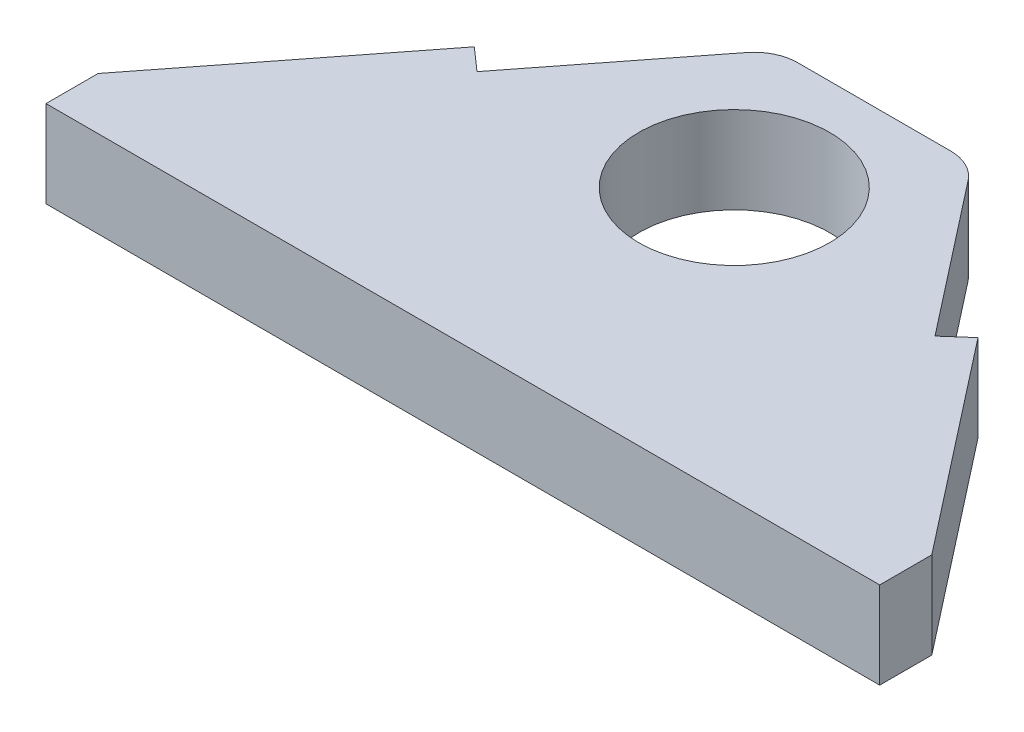
from build123d import *

# Parameters (mm, degrees)
SKETCH1_R           = 22
BOSS_EXTRUDE1_DEPTH = 20


with BuildPart() as part:
    # Sketch1 → Boss-Extrude1 (new body)
    # profile 1 of 4: a face of its own
    with BuildSketch(Plane(origin=(0, 0, 0), x_dir=(1, 0, 0), z_dir=(0, 1, 0))):
        with BuildLine():
            Line((-96, -62.5), (96, -62.5))
            Line((96, -62.5), (96, -50.5))
            Line((96, -50.5), (57.998267127, -1.86))
            Line((57.998267127, -1.86), (52.740304928, -6.5))
            Line((52.740304928, -6.5), (32.582594335, 19.300692998))
            Line((32.582594335, 19.300692998), (25.496396068, 28.370613174))
            ThreePointArc((25.496396068, 28.370613174), (22, 31.201938883), (17.616288532, 32.21399842))
            Line((17.616288532, 32.21399842), (-17.616288532, 32.21399842))
            ThreePointArc((-17.616288532, 32.21399842), (-22, 31.201938883), (-25.496396068, 28.370613174))
            Line((-25.496396068, 28.370613174), (-32.582594335, 19.300692998))
            Line((-32.582594335, 19.300692998), (-52.740304928, -6.5))
            Line((-52.740304928, -6.5), (-57.998267127, -1.86))
            Line((-57.998267127, -1.86), (-96, -50.5))
            Line((-96, -50.5), (-96, -62.5))
        make_face()
        with Locations(Location((0, 0, 0), (0, 0, 270))):
            Circle(SKETCH1_R, mode=Mode.SUBTRACT)
    # profile 2 of 4: a face of its own
    with BuildSketch(Plane(origin=(0, 0, 0), x_dir=(1, 0, 0), z_dir=(0, 1, 0))):
        with BuildLine():
            Line((-96, -62.5), (96, -62.5))
            Line((96, -62.5), (96, -50.5))
            Line((96, -50.5), (57.998267127, -1.86))
            Line((57.998267127, -1.86), (52.740304928, -6.5))
            Line((52.740304928, -6.5), (32.582594335, 19.300692998))
            Line((32.582594335, 19.300692998), (25.496396068, 28.370613174))
            ThreePointArc((25.496396068, 28.370613174), (22, 31.201938883), (17.616288532, 32.21399842))
            Line((17.616288532, 32.21399842), (-17.616288532, 32.21399842))
            ThreePointArc((-17.616288532, 32.21399842), (-22, 31.201938883), (-25.496396068, 28.370613174))
            Line((-25.496396068, 28.370613174), (-32.582594335, 19.300692998))
            Line((-32.582594335, 19.300692998), (-52.740304928, -6.5))
            Line((-52.740304928, -6.5), (-57.998267127, -1.86))
            Line((-57.998267127, -1.86), (-96, -50.5))
            Line((-96, -50.5), (-96, -62.5))
        make_face()
        with Locations(Location((0, 0, 0), (0, 0, 270))):
            Circle(SKETCH1_R, mode=Mode.SUBTRACT)
    # profile 3 of 4: a face of its own
    with BuildSketch(Plane(origin=(0, 0, 0), x_dir=(1, 0, 0), z_dir=(0, 1, 0))):
        with BuildLine():
            Line((-96, -62.5), (96, -62.5))
            Line((96, -62.5), (96, -50.5))
            Line((96, -50.5), (57.998267127, -1.86))
            Line((57.998267127, -1.86), (52.740304928, -6.5))
            Line((52.740304928, -6.5), (32.582594335, 19.300692998))
            Line((32.582594335, 19.300692998), (25.496396068, 28.370613174))
            ThreePointArc((25.496396068, 28.370613174), (22, 31.201938883), (17.616288532, 32.21399842))
            Line((17.616288532, 32.21399842), (-17.616288532, 32.21399842))
            ThreePointArc((-17.616288532, 32.21399842), (-22, 31.201938883), (-25.496396068, 28.370613174))
            Line((-25.496396068, 28.370613174), (-32.582594335, 19.300692998))
            Line((-32.582594335, 19.300692998), (-52.740304928, -6.5))
            Line((-52.740304928, -6.5), (-57.998267127, -1.86))
            Line((-57.998267127, -1.86), (-96, -50.5))
            Line((-96, -50.5), (-96, -62.5))
        make_face()
        with Locations(Location((0, 0, 0), (0, 0, 270))):
            Circle(SKETCH1_R, mode=Mode.SUBTRACT)
    # profile 4 of 4: a face of its own
    with BuildSketch(Plane(origin=(0, 0, 0), x_dir=(1, 0, 0), z_dir=(0, 1, 0))):
        with BuildLine():
            Line((-96, -62.5), (96, -62.5))
            Line((96, -62.5), (96, -50.5))
            Line((96, -50.5), (57.998267127, -1.86))
            Line((57.998267127, -1.86), (52.740304928, -6.5))
            Line((52.740304928, -6.5), (32.582594335, 19.300692998))
            Line((32.582594335, 19.300692998), (25.496396068, 28.370613174))
            ThreePointArc((25.496396068, 28.370613174), (22, 31.201938883), (17.616288532, 32.21399842))
            Line((17.616288532, 32.21399842), (-17.616288532, 32.21399842))
            ThreePointArc((-17.616288532, 32.21399842), (-22, 31.201938883), (-25.496396068, 28.370613174))
            Line((-25.496396068, 28.370613174), (-32.582594335, 19.300692998))
            Line((-32.582594335, 19.300692998), (-52.740304928, -6.5))
            Line((-52.740304928, -6.5), (-57.998267127, -1.86))
            Line((-57.998267127, -1.86), (-96, -50.5))
            Line((-96, -50.5), (-96, -62.5))
        make_face()
        with Locations(Location((0, 0, 0), (0, 0, 270))):
            Circle(SKETCH1_R, mode=Mode.SUBTRACT)
    extrude(amount=BOSS_EXTRUDE1_DEPTH)


solid = part.part
